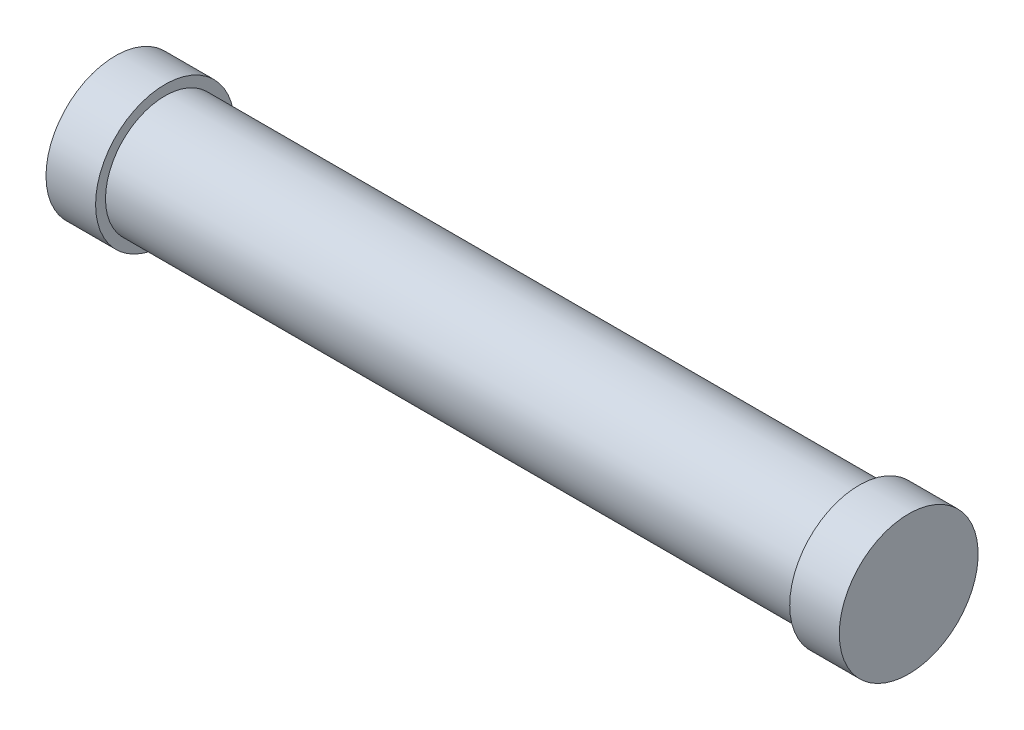
from build123d import *

# Parameters (mm, degrees)
SKETCH1_W           = 70
SKETCH1_H           = 6
SKETCH2_R           = 7
BOSS_EXTRUDE1_DEPTH = 5


with BuildPart() as part:
    # Sketch1 → Revolve1 (revolve)
    with BuildSketch(Plane(origin=(0, 0, 0), x_dir=(1, 0, 0), z_dir=(0, 1, 0)), mode=Mode.PRIVATE) as revolve1_sk:
        with Locations((0.279538905, 9)):
            Rectangle(SKETCH1_W, SKETCH1_H)
    revolve(revolve1_sk.sketch.rotate(Axis((-34.720461095, 0, -6), (1, 0, 0)), 180), axis=Axis((-34.720461095, 0, -6), (1, 0, 0)))

    # Sketch2 → Boss-Extrude1 (add)
    with BuildSketch(Plane.ZY.offset(34.720461095)):
        with Locations((-6, 0)):
            Circle(SKETCH2_R)
    boss_extrude1 = extrude(amount=BOSS_EXTRUDE1_DEPTH)

    # Mirror1: Boss-Extrude1 across plane
    add(boss_extrude1.mirror(Plane(origin=(0.279538905, 0, 0), x_dir=(0, 0, 1), z_dir=(1, 0, 0))))


solid = part.part
